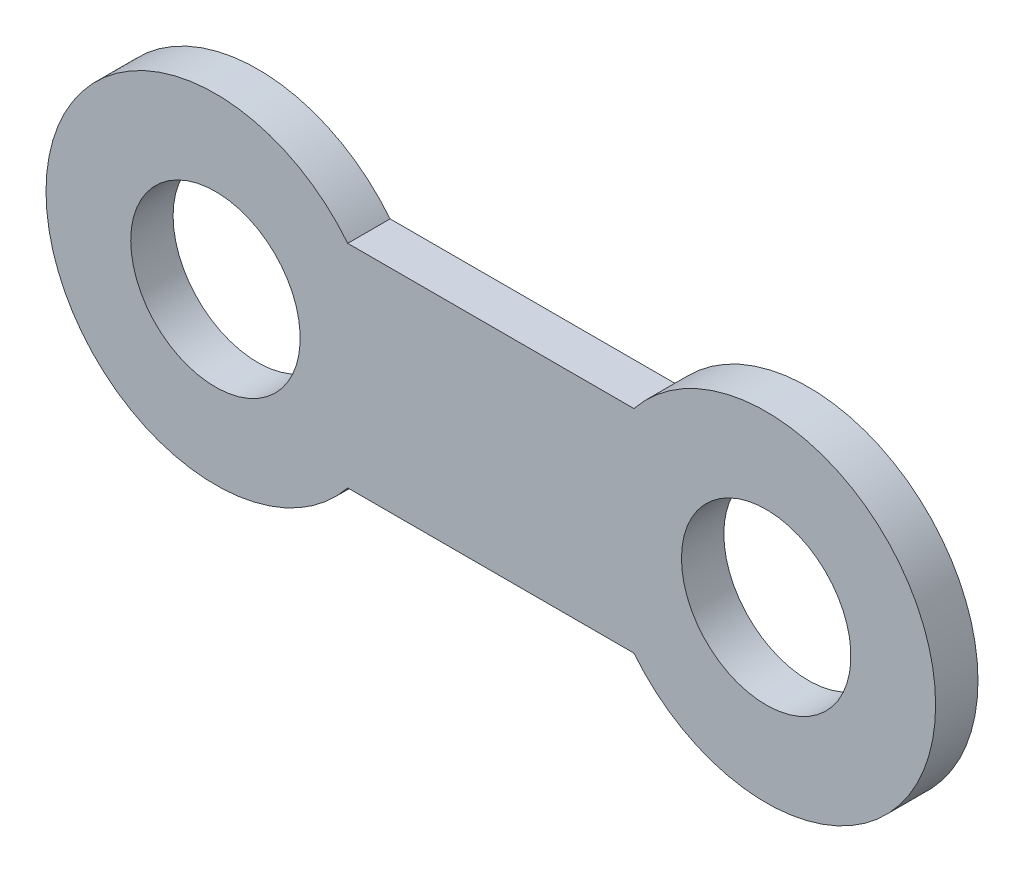
from build123d import *

# Parameters (mm, degrees)
SKETCH_1_W          = 85
SKETCH_1_H          = 25
EXTRUDE_1_DEPTH     = 5
SKETCH_2_R          = 20
EXTRUDE_2_DEPTH     = 5
SKETCH_3_R          = 10
CUT_EXTRUDE_1_DEPTH = 35


with BuildPart() as part:
    # 草图1 → 凸台-拉伸1 (new body)
    with BuildSketch(Plane.XY):
        Rectangle(SKETCH_1_W, SKETCH_1_H)
    extrude(amount=EXTRUDE_1_DEPTH)

    # 草图2 → 凸台-拉伸2 (add)
    with BuildSketch(Plane.XY.offset(5)):
        with Locations((32.5, 0)):
            Circle(SKETCH_2_R)
        with Locations((-32.5, 0)):
            Circle(SKETCH_2_R)
    extrude(amount=-EXTRUDE_2_DEPTH)

    # 草图3 → 切除-拉伸1 (cut)
    with BuildSketch(Plane(origin=(0, 0, 0), x_dir=(-1, 0, 0), z_dir=(0, 0, -1))):
        with Locations((-32.5, 0)):
            Circle(SKETCH_3_R)
        with Locations((32.5, 0)):
            Circle(SKETCH_3_R)
    extrude(amount=-CUT_EXTRUDE_1_DEPTH, mode=Mode.SUBTRACT)


solid = part.part
